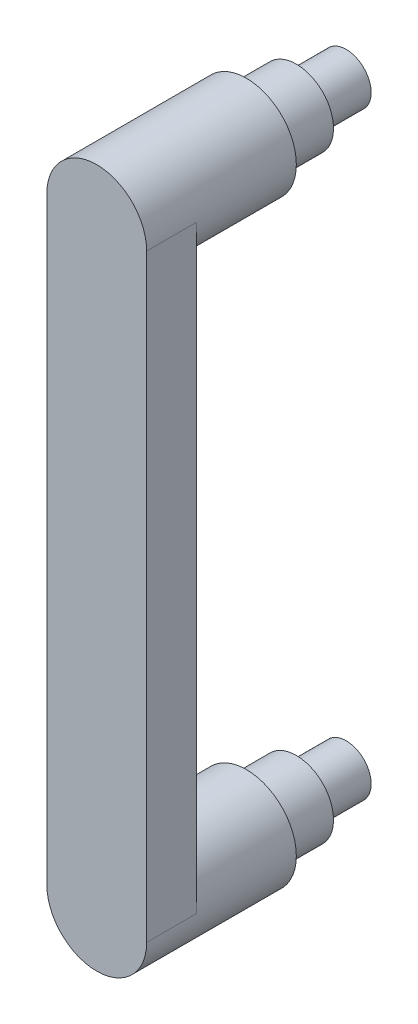
from build123d import *

# Parameters (mm, degrees)
SKETCH_1_R                       = 1.49
EXTRUDE_1_DEPTH                  = 4
SKETCH_2_R                       = 2
EXTRUDE_2_DEPTH                  = 4
EXTRUDE_START                    = 4
SKETCH_3_R                       = 2
EXTRUDE_3_DEPTH                  = 4
SKETCH_4_W                       = 4
SKETCH_4_H                       = 2
EXTRUDE_4_DEPTH                  = 12
EXTRUDE_4_DIRECTION_2_REACH      = 10.485
EXTRUDE_4_DIRECTION_2_END_RADIUS = 2
SKETCH_6_W                       = 4
SKETCH_6_H                       = 2
EXTRUDE_5_DEPTH                  = 12
EXTRUDE_5_DIRECTION_2_REACH      = 16.56
EXTRUDE_5_DIRECTION_2_END_RADIUS = 2
CUT_EXTRUDE_1_DEPTH              = 12
CUT_EXTRUDE_1_DEPTH_BACK         = 12
SKETCH_7_W                       = 8
SKETCH_7_H                       = 28
SKETCH_8_R                       = 1
EXTRUDE_6_DEPTH                  = 2


with BuildPart() as part:
    # 草图1 → 凸台-拉伸1 (new body)
    with BuildSketch(Plane.XY):
        Circle(SKETCH_1_R)
    extrude(amount=EXTRUDE_1_DEPTH)

    # 草图2 → 凸台-拉伸2 (add)
    with BuildSketch(Plane(origin=(0, 0, 0), x_dir=(-1, 0, 0), z_dir=(0, 0, -1))):
        Circle(SKETCH_2_R)
    extrude(amount=EXTRUDE_2_DEPTH)

    # 草图3 → 凸台-拉伸3 (add)
    with BuildSketch(Plane.XY.offset(4).offset(EXTRUDE_START)):
        with Locations(Location((0, 0, 0), (0, 0, 180))):
            Circle(SKETCH_3_R)
    extrude(amount=-EXTRUDE_3_DEPTH)

    # 草图4 → 凸台-拉伸4 (add)
    with BuildSketch(Plane(origin=(0, 0, 0), x_dir=(1, 0, 0), z_dir=(0, 1, 0))):
        with Locations((0, 5)):
            Rectangle(SKETCH_4_W, SKETCH_4_H)
    extrude(amount=EXTRUDE_4_DEPTH)

    # 凸台-拉伸4 direction 2: up to this cylinder (the profile starts inside it)
    extrude_4_direction_2_end = Plane(origin=(0, 0, -5), z_dir=(0, 0, 1)) * Cylinder(EXTRUDE_4_DIRECTION_2_END_RADIUS, 25.97, mode=Mode.PRIVATE)
    # 草图4 → 凸台-拉伸4 direction 2 (add, up to the surface)
    with BuildSketch(Plane(origin=(0, 0, 0), x_dir=(1, 0, 0), z_dir=(0, 1, 0)), mode=Mode.PRIVATE) as extrude_4_direction_2_sk1:
        with Locations((0, 5)):
            Rectangle(SKETCH_4_W, SKETCH_4_H)
    extrude_4_direction_2_tool1 = extrude(extrude_4_direction_2_sk1.sketch, amount=-EXTRUDE_4_DIRECTION_2_REACH, mode=Mode.PRIVATE) & extrude_4_direction_2_end
    add(extrude_4_direction_2_tool1.solids().sort_by_distance((0, 0, -5))[0])

    # 草图6 → 凸台-拉伸5 (add)
    with BuildSketch(Plane(origin=(0, 0, 0), x_dir=(1, 0, 0), z_dir=(0, 1, 0))):
        with Locations((0, -9)):
            Rectangle(SKETCH_6_W, SKETCH_6_H)
    extrude(amount=EXTRUDE_5_DEPTH)

    # 凸台-拉伸5 direction 2: up to this cylinder (the profile starts inside it)
    extrude_5_direction_2_end = Plane(origin=(0, 0, 9), z_dir=(0, 0, -1)) * Cylinder(EXTRUDE_5_DIRECTION_2_END_RADIUS, 38.12, mode=Mode.PRIVATE)
    # 草图6 → 凸台-拉伸5 direction 2 (add, up to the surface)
    with BuildSketch(Plane(origin=(0, 0, 0), x_dir=(1, 0, 0), z_dir=(0, 1, 0)), mode=Mode.PRIVATE) as extrude_5_direction_2_sk1:
        with Locations((0, -9)):
            Rectangle(SKETCH_6_W, SKETCH_6_H)
    extrude_5_direction_2_tool1 = extrude(extrude_5_direction_2_sk1.sketch, amount=-EXTRUDE_5_DIRECTION_2_REACH, mode=Mode.PRIVATE) & extrude_5_direction_2_end
    add(extrude_5_direction_2_tool1.solids().sort_by_distance((0, 0, 9))[0])

    # 镜向2: part across plane


with BuildPart() as part_1:
    add(part.part)
    add(part.part.mirror(Plane.ZX.offset(12)))

    # 草图7 → 切除-拉伸1 (cut, two sides: drawn at the far end of the back side and taken through both)
    with BuildSketch(Plane(origin=(0, 0, 0), x_dir=(0, 0, -1), z_dir=(1, 0, 0)).offset(-CUT_EXTRUDE_1_DEPTH_BACK)):
        with Locations((2, 12)):
            Rectangle(SKETCH_7_W, SKETCH_7_H)
    extrude(amount=CUT_EXTRUDE_1_DEPTH + CUT_EXTRUDE_1_DEPTH_BACK, mode=Mode.SUBTRACT)

    # 草图8 → 凸台-拉伸6 (add)
    with BuildSketch(Plane(origin=(0, 0, 2), x_dir=(-1, 0, 0), z_dir=(0, 0, -1))):
        with Locations((0, 24)):
            Circle(SKETCH_8_R)
        Circle(SKETCH_8_R)
    extrude(amount=EXTRUDE_6_DEPTH)


solid = part_1.part
